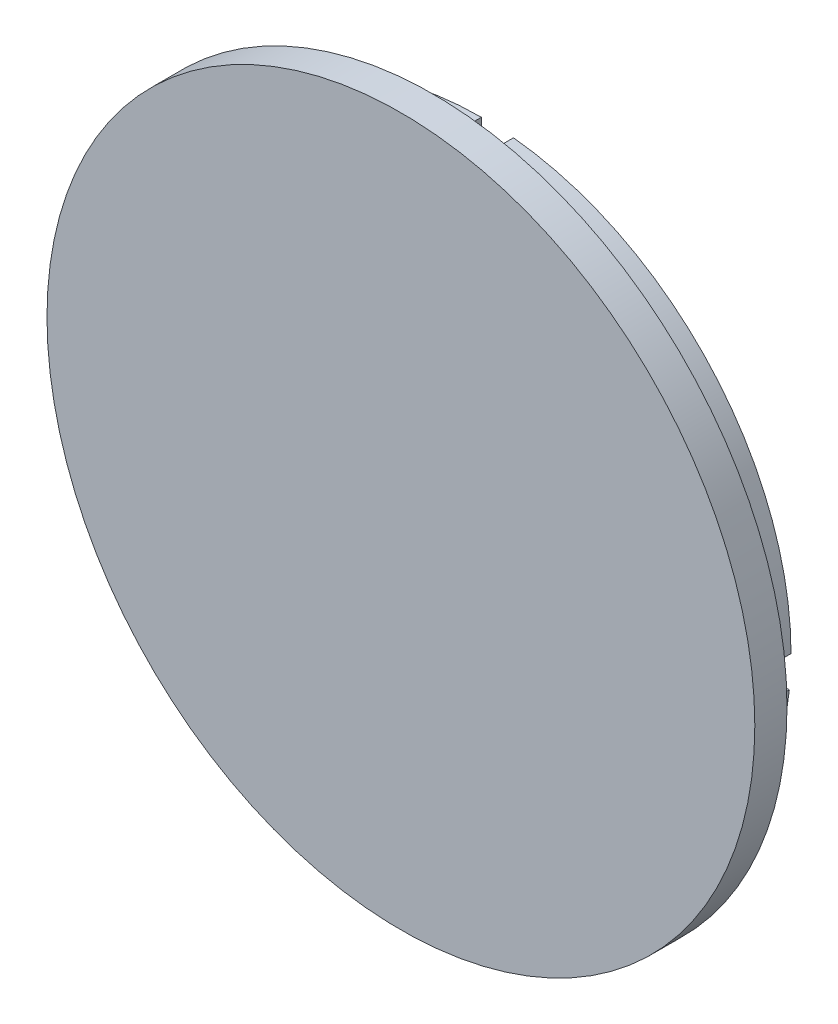
from build123d import *

# Parameters (mm, degrees)
SCHIZZO1_R                   = 19.25
SCHIZZO1_R_2                 = 18.25
ESTRUSIONE_ESTRUSIONE1_DEPTH = 3
SCHIZZO2_R                   = 22
ESTRUSIONE_ESTRUSIONE2_DEPTH = 2
TAGLIO_ESTRUSIONE1_DEPTH     = 3


with BuildPart() as part:
    # Schizzo1 → Estrusione-Estrusione1 (new body)
    with BuildSketch(Plane.XY):
        Circle(SCHIZZO1_R)
        Circle(SCHIZZO1_R_2, mode=Mode.SUBTRACT)
    extrude(amount=ESTRUSIONE_ESTRUSIONE1_DEPTH)

    # Schizzo2 → Estrusione-Estrusione2 (add)
    with BuildSketch(Plane.XY.offset(3)):
        Circle(SCHIZZO2_R)
    extrude(amount=ESTRUSIONE_ESTRUSIONE2_DEPTH)

    # Schizzo3 → Taglio-Estrusione1 (cut)
    with BuildSketch(Plane(origin=(0, 0, 0), x_dir=(-1, 0, 0), z_dir=(0, 0, -1))):
        with BuildLine():
            Line((0, 18.25), (0, 19.25))
            ThreePointArc((0, 19.25), (-1.001355713, 19.223937857), (-2, 19.145821999))
            Line((-2, 19.145821999), (-2, 18.140079934))
            ThreePointArc((-2, 18.140079934), (-1.001509164, 18.222499263), (0, 18.25))
        make_face()
        with BuildLine():
            Line((-18.25, 0), (-19.25, 0))
            ThreePointArc((-19.25, 0), (-19.223937857, -1.001355713), (-19.145821999, -2))
            Line((-19.145821999, -2), (-18.140079934, -2))
            ThreePointArc((-18.140079934, -2), (-18.222499263, -1.001509164), (-18.25, 0))
        make_face()
        with BuildLine():
            ThreePointArc((-2, -19.145821999), (-1.001355713, -19.223937857), (0, -19.25))
            Line((0, -19.25), (0, -18.25))
            ThreePointArc((0, -18.25), (-1.001509164, -18.222499263), (-2, -18.140079934))
            Line((-2, -18.140079934), (-2, -19.145821999))
        make_face()
        with BuildLine():
            ThreePointArc((19.145821999, -2), (19.223937857, -1.001355713), (19.25, 0))
            Line((19.25, 0), (18.25, 0))
            ThreePointArc((18.25, 0), (18.222499263, -1.001509164), (18.140079934, -2))
            Line((18.140079934, -2), (19.145821999, -2))
        make_face()
    extrude(amount=-TAGLIO_ESTRUSIONE1_DEPTH, mode=Mode.SUBTRACT)


solid = part.part
